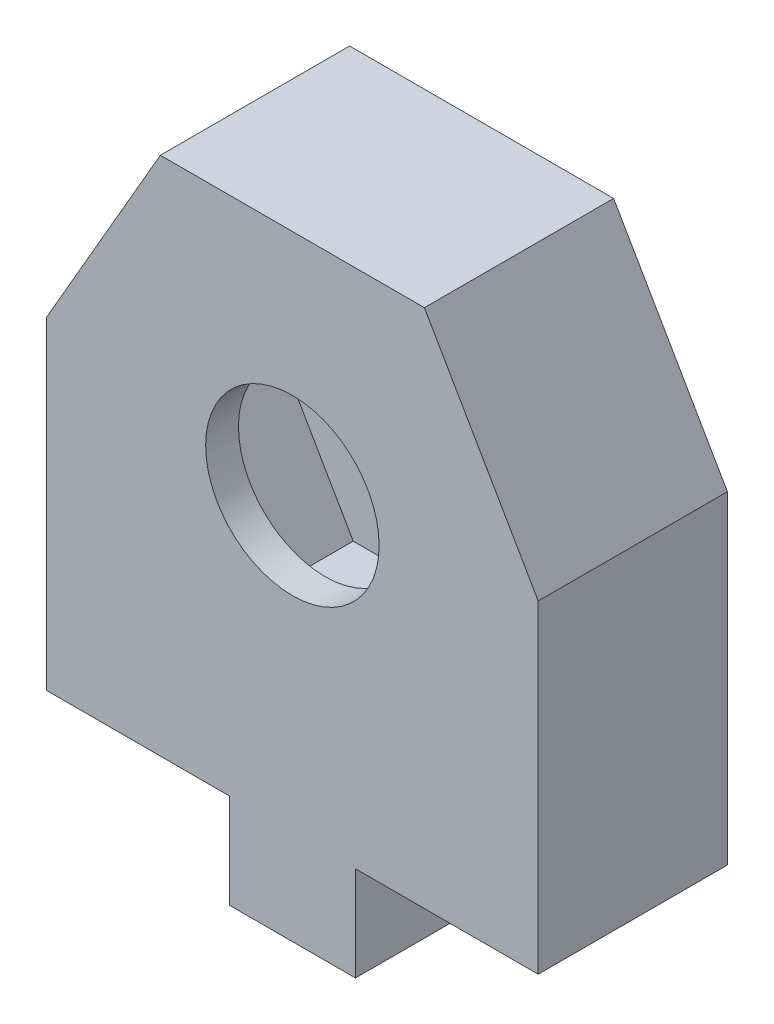
from build123d import *

# Parameters (mm, degrees)
SKETCH1_R           = 1.375
BOSS_EXTRUDE1_DEPTH = 3
CUT_EXTRUDE1_DEPTH  = 0.98


with BuildPart() as part:
    # Sketch1 → Boss-Extrude1 (new body)
    with BuildSketch(Plane.XY):
        Polygon((-1, -4.625), (-1, -6.125), (1, -6.125), (1, -4.625), (3.897114317, -4.625), (3.897114317, 0.5), (2.092894726, 3.625), (-2.092894726, 3.625), (-3.897114317, 0.5), (-3.897114317, -4.625), align=None)
        Circle(SKETCH1_R, mode=Mode.SUBTRACT)
    extrude(amount=BOSS_EXTRUDE1_DEPTH)

    # Sketch2 → Cut-Extrude1 (cut, symmetric)
    with BuildSketch(Plane.XY.offset(1.5)):
        Polygon((-1.515544457, -2.625), (1.515544457, -2.625), (3.031088913, 0), (1.515544457, 2.625), (-1.515544457, 2.625), (-3.031088913, 0), align=None)
    extrude(amount=CUT_EXTRUDE1_DEPTH, both=True, mode=Mode.SUBTRACT)


solid = part.part
